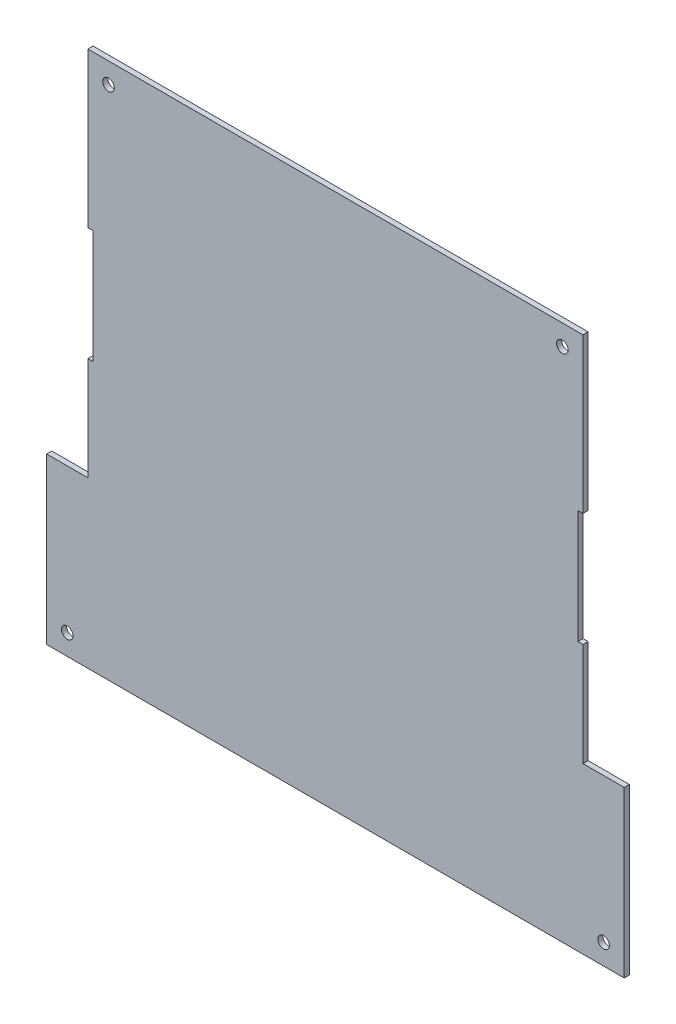
from build123d import *

# Parameters (mm, degrees)
SKETCH1_W               = 304.8
SKETCH1_H               = 330.2
BOSS_EXTRUDE1_DEPTH     = 3.175
F_1_4_CLEARANCE_HOLE1_D = 7.14248
CUT_EXTRUDE1_REACH      = 451.383
SKETCH4_W               = 3.175
SKETCH4_H               = 69.85
SKETCH5_W               = 25.4
SKETCH5_H               = 101.6
BOSS_EXTRUDE2_DEPTH     = 3.175
F_1_4_CLEARANCE_HOLE2_D = 7.14248


with BuildPart() as part:
    # Sketch1 → Boss-Extrude1 (new body)
    with BuildSketch(Plane.XY):
        with Locations((152.4, -165.1)):
            Rectangle(SKETCH1_W, SKETCH1_H)
    extrude(amount=BOSS_EXTRUDE1_DEPTH)

    # 1/4 Clearance Hole1 (through all)
    with Locations(Plane.XY.offset(3.175)):
        with Locations((12.7, -12.7), (292.1, -12.7)):
            Hole(F_1_4_CLEARANCE_HOLE1_D / 2)

    # Sketch4 → Cut-Extrude1 (cut, up to next)
    with BuildSketch(Plane.XY.offset(3.175), mode=Mode.PRIVATE) as cut_extrude1_sk1:
        with Locations((303.2125, -130.175)):
            Rectangle(SKETCH4_W, SKETCH4_H)
    cut_extrude1_tool1 = extrude(cut_extrude1_sk1.sketch, amount=-CUT_EXTRUDE1_REACH, mode=Mode.PRIVATE) & part.part
    # Sketch4 → Cut-Extrude1 (cut, up to next)
    with BuildSketch(Plane.XY.offset(3.175), mode=Mode.PRIVATE) as cut_extrude1_sk2:
        with Locations((1.5875, -130.175)):
            Rectangle(SKETCH4_W, SKETCH4_H)
    cut_extrude1_tool2 = extrude(cut_extrude1_sk2.sketch, amount=-CUT_EXTRUDE1_REACH, mode=Mode.PRIVATE) & part.part
    add(cut_extrude1_tool1.solids().sort_by_distance((303.2125, -130.175, 3.175))[0], mode=Mode.SUBTRACT)
    add(cut_extrude1_tool2.solids().sort_by_distance((1.5875, -130.175, 3.175))[0], mode=Mode.SUBTRACT)

    # Sketch5 → Boss-Extrude2 (add)
    with BuildSketch(Plane.XY.offset(3.175)):
        with Locations((-12.7, -279.4)):
            Rectangle(SKETCH5_W, SKETCH5_H)
        with Locations((317.5, -279.4)):
            Rectangle(SKETCH5_W, SKETCH5_H)
    extrude(amount=-BOSS_EXTRUDE2_DEPTH)

    # 1/4 Clearance Hole2 (through all)
    with Locations(Plane.XY.offset(3.175)):
        with Locations((317.5, -317.5), (-12.7, -317.5)):
            Hole(F_1_4_CLEARANCE_HOLE2_D / 2)


solid = part.part
